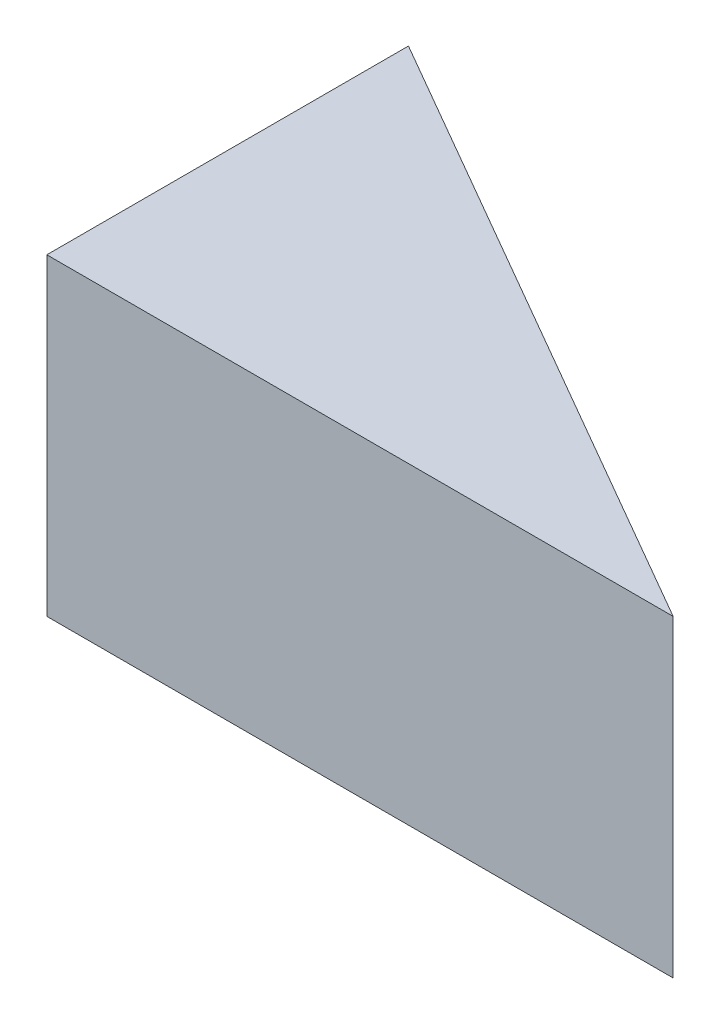
from build123d import *

# Parameters (mm, degrees)
BOSS_EXTRUDE1_DEPTH = 20


with BuildPart() as part:
    # Sketch1 → Boss-Extrude1 (new body)
    with BuildSketch(Plane(origin=(0, 0, 0), x_dir=(1, 0, 0), z_dir=(0, 1, 0))):
        Polygon((0, 0), (40, 0), (0, 23.094010768), align=None)
    extrude(amount=BOSS_EXTRUDE1_DEPTH)


solid = part.part
